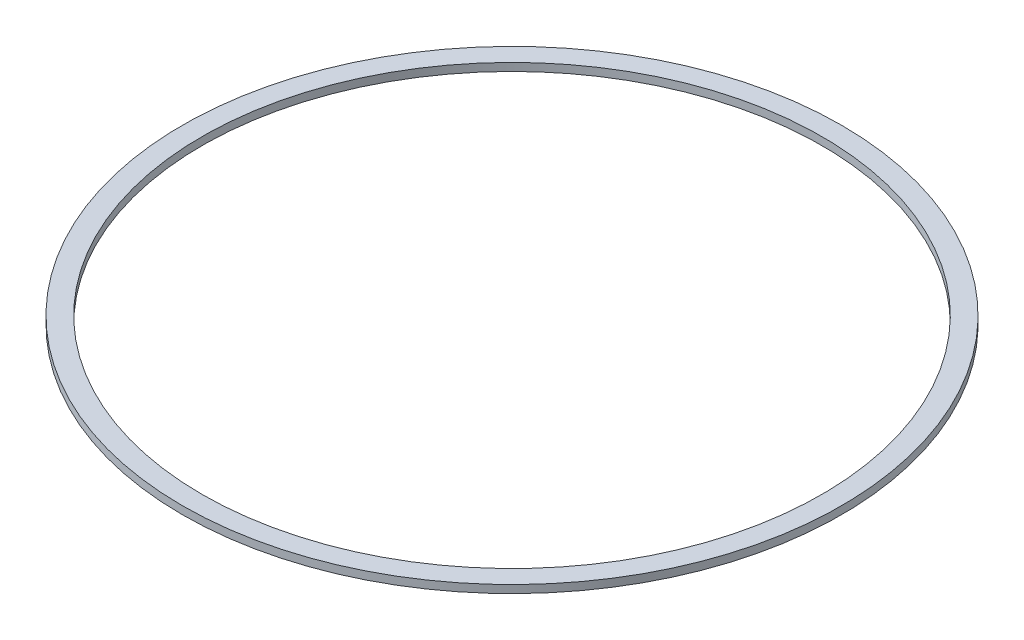
from build123d import *

# Parameters (mm, degrees)
SKETCH1_R           = 42
SKETCH1_R_2         = 39.5
BOSS_EXTRUDE1_DEPTH = 1


with BuildPart() as part:
    # Sketch1 → Boss-Extrude1 (new body)
    with BuildSketch(Plane(origin=(0, 0, 0), x_dir=(1, 0, 0), z_dir=(0, 1, 0))):
        with Locations(Location((0, 0, 0), (0, 0, 270))):
            Circle(SKETCH1_R)
        with Locations(Location((0, 0, 0), (0, 0, 270))):
            Circle(SKETCH1_R_2, mode=Mode.SUBTRACT)
    extrude(amount=BOSS_EXTRUDE1_DEPTH)


solid = part.part
